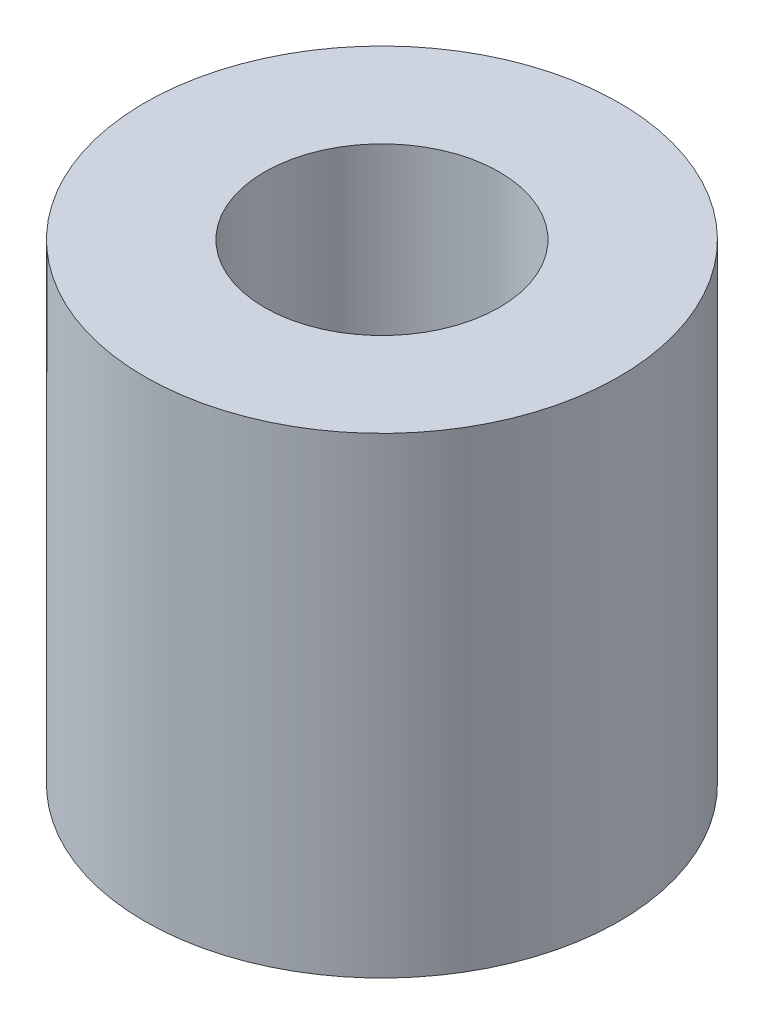
from build123d import *

# Parameters (mm, degrees)
SKETCH1_R           = 2.5146
SKETCH1_R_2         = 1.2446
BOSS_EXTRUDE1_DEPTH = 2.5


with BuildPart() as part:
    # Sketch1 → Boss-Extrude1 (new, symmetric)
    with BuildSketch(Plane(origin=(0, 0, 0), x_dir=(1, 0, 0), z_dir=(0, 1, 0))):
        with Locations(Location((0, 0, 0), (0, 0, 270))):
            Circle(SKETCH1_R)
        with Locations(Location((0, 0, 0), (0, 0, 270))):
            Circle(SKETCH1_R_2, mode=Mode.SUBTRACT)
    extrude(amount=BOSS_EXTRUDE1_DEPTH, both=True)


solid = part.part
